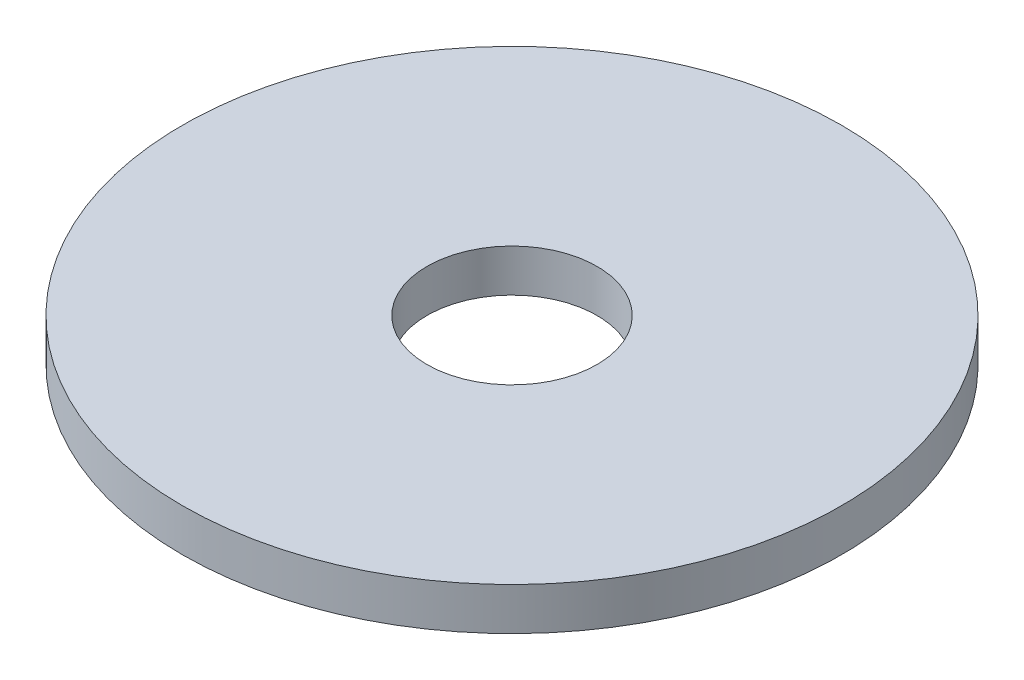
from build123d import *

# Parameters (mm, degrees)
SKETCH1_R           = 15.5
SKETCH1_R_2         = 4
BOSS_EXTRUDE1_DEPTH = 2


with BuildPart() as part:
    # Sketch1 → Boss-Extrude1 (new body)
    with BuildSketch(Plane(origin=(0, 0, 0), x_dir=(1, 0, 0), z_dir=(0, 1, 0))):
        with Locations(Location((0, 0, 0), (0, 0, 270))):
            Circle(SKETCH1_R)
        with Locations(Location((0, 0, 0), (0, 0, 270))):
            Circle(SKETCH1_R_2, mode=Mode.SUBTRACT)
    extrude(amount=BOSS_EXTRUDE1_DEPTH)


solid = part.part
